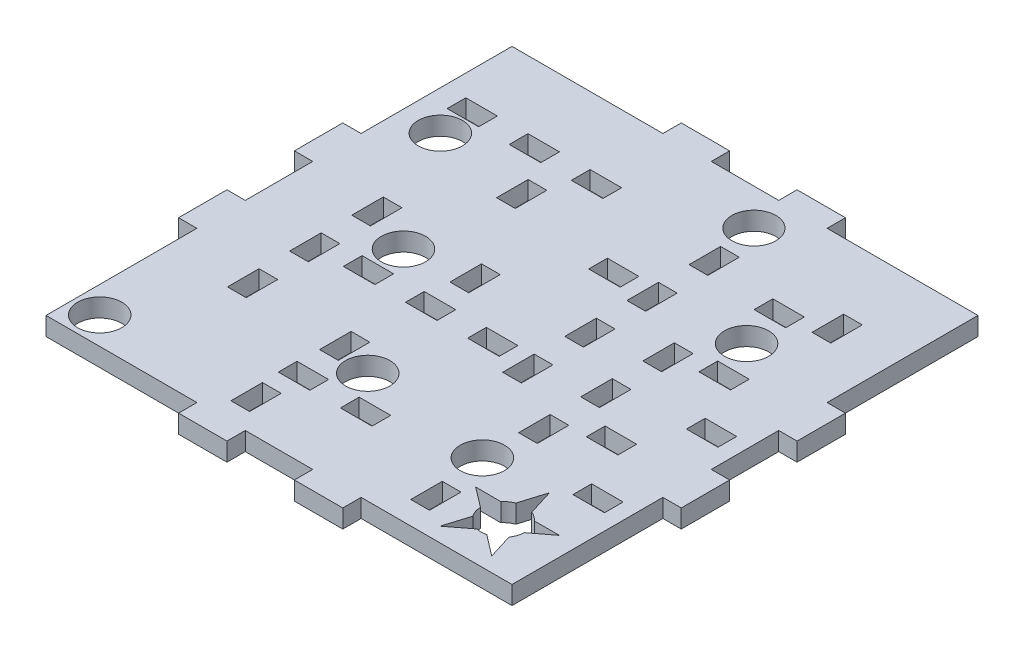
from build123d import *

# Parameters (mm, degrees)
SKETCH1_R           = 6
SKETCH1_R_2         = 6.0325
SKETCH1_W           = 8.6007
SKETCH1_H           = 5.1
SKETCH1_W_2         = 8.6042
SKETCH1_W_3         = 5.1
SKETCH1_H_2         = 8.6007
SKETCH1_H_3         = 8.6042
SKETCH1_H_4         = 8.6043
SKETCH1_W_4         = 8.6043
BOSS_EXTRUDE1_DEPTH = 5


with BuildPart() as part:
    # Sketch1 → Boss-Extrude1 (new body)
    with BuildSketch(Plane(origin=(0, 0, 0), x_dir=(1, 0, 0), z_dir=(0, 1, 0))):
        Polygon((-91.476831165, 14.589919239), (-91.476831165, 55.753419239), (-86.476831165, 55.753419239), (-86.476831165, 68.953419239), (-91.476831165, 68.953419239), (-91.476831165, 87.353419239), (-86.476831165, 87.353419239), (-86.476831165, 100.553419239), (-91.476831165, 100.553419239), (-91.476831165, 141.716919239), (-132.640331165, 141.716919239), (-132.640331165, 146.716919239), (-145.840331165, 146.716919239), (-145.840331165, 141.716919239), (-164.240331165, 141.716919239), (-164.240331165, 146.716919239), (-177.440331165, 146.716919239), (-177.440331165, 141.716919239), (-218.603831165, 141.716919239), (-218.603831165, 100.553419239), (-223.603831165, 100.553419239), (-223.603831165, 87.353419239), (-218.603831165, 87.353419239), (-218.603831165, 68.953419239), (-223.603831165, 68.953419239), (-223.603831165, 55.753419239), (-218.603831165, 55.753419239), (-218.603831165, 14.589919239), (-177.440331165, 14.589919239), (-177.440331165, 9.589919239), (-164.240331165, 9.589919239), (-164.240331165, 14.589919239), (-145.840331165, 14.589919239), (-145.840331165, 9.589919239), (-132.640331165, 9.589919239), (-132.640331165, 14.589919239), align=None)
        with Locations(Location((-142.678531165, 131.780119239, 0), (0, 0, 270))):
            Circle(SKETCH1_R, mode=Mode.SUBTRACT)
        with Locations(Location((-207.878131165, 111.439219239, 0), (0, 0, 270))):
            Circle(SKETCH1_R_2, mode=Mode.SUBTRACT)
        with Locations(Location((-116.398131165, 103.504519239, 0), (0, 0, 270))):
            Circle(SKETCH1_R_2, mode=Mode.SUBTRACT)
        with Locations(Location((-125.423931165, 40.453519239, 0), (0, 0, 270))):
            Circle(SKETCH1_R_2, mode=Mode.SUBTRACT)
        with Locations(Location((-161.052331165, 44.809519239, 0), (0, 0, 270))):
            Circle(SKETCH1_R_2, mode=Mode.SUBTRACT)
        with Locations(Location((-185.528131165, 79.031719239, 0), (0, 0, 270))):
            Circle(SKETCH1_R_2, mode=Mode.SUBTRACT)
        with Locations(Location((-211.39466844, 22.031131301, 0), (0, 0, 270))):
            Circle(SKETCH1_R_2, mode=Mode.SUBTRACT)
        with BuildLine():
            Line((-103.453731165, 32.644519239), (-96.590531165, 32.658419239))
            Line((-96.590531165, 32.658419239), (-102.031531165, 28.518719239))
            add(Edge.make_bspline(
                [(-102.031531165, 28.518719239), (-102.078231165, 27.350319239), (-102.459531165, 26.268019239), (-103.082231165, 25.364719239)],
                knots=[0.176470588, 0.176470588, 0.176470588, 0.176470588, 0.235294118, 0.235294118, 0.235294118, 0.235294118], degree=3))
            Line((-103.082231165, 25.364719239), (-100.956331165, 18.530119239))
            Line((-100.956331165, 18.530119239), (-106.678331165, 22.919119239))
            add(Edge.make_bspline(
                [(-106.678331165, 22.919119239), (-107.109931165, 22.820319239), (-107.559131165, 22.768019239), (-108.020631165, 22.768019239)],
                knots=[0.352941176, 0.352941176, 0.352941176, 0.352941176, 0.411764706, 0.411764706, 0.411764706, 0.411764706], degree=3))
            add(Edge.make_bspline(
                [(-108.020631165, 22.768019239), (-108.482031165, 22.768019239), (-108.931331165, 22.820319239), (-109.362831165, 22.919019239)],
                knots=[0.411764706, 0.411764706, 0.411764706, 0.411764706, 0.470588235, 0.470588235, 0.470588235, 0.470588235], degree=3))
            Line((-109.362831165, 22.919019239), (-115.084731165, 18.530119239))
            Line((-115.084731165, 18.530119239), (-112.958831165, 25.364719239))
            add(Edge.make_bspline(
                [(-112.958831165, 25.364719239), (-113.581531165, 26.267919239), (-113.962731165, 27.350319239), (-114.009531165, 28.518719239)],
                knots=[0.588235294, 0.588235294, 0.588235294, 0.588235294, 0.647058824, 0.647058824, 0.647058824, 0.647058824], degree=3))
            Line((-114.009531165, 28.518719239), (-119.450531165, 32.658419239))
            Line((-119.450531165, 32.658419239), (-112.587331165, 32.644519239))
            add(Edge.make_bspline(
                [(-112.587331165, 32.644519239), (-111.945431165, 33.398919239), (-111.119931165, 33.992119239), (-110.180131165, 34.355419239)],
                knots=[0.764705882, 0.764705882, 0.764705882, 0.764705882, 0.823529412, 0.823529412, 0.823529412, 0.823529412], degree=3))
            Line((-110.180131165, 34.355419239), (-108.020531165, 41.390119239))
            Line((-108.020531165, 41.390119239), (-105.860931165, 34.355419239))
            add(Edge.make_bspline(
                [(-105.860931165, 34.355419239), (-104.921031165, 33.992119239), (-104.095631165, 33.398819239), (-103.453731165, 32.644519239)],
                knots=[0, 0, 0, 0, 0.058823529, 0.058823529, 0.058823529, 0.058823529], degree=3))
        make_face(mode=Mode.SUBTRACT)
        with Locations((-169.226281165, 35.444819239)):
            Rectangle(SKETCH1_W, SKETCH1_H, mode=Mode.SUBTRACT)
        with Locations((-152.277031165, 35.444819239)):
            Rectangle(SKETCH1_W_2, SKETCH1_H, mode=Mode.SUBTRACT)
        with Locations((-123.880731165, 55.644269239)):
            Rectangle(SKETCH1_W_3, SKETCH1_H_2, mode=Mode.SUBTRACT)
        with Locations((-123.880731165, 72.593519239)):
            Rectangle(SKETCH1_W_3, SKETCH1_H_3, mode=Mode.SUBTRACT)
        with Locations((-123.880731165, 89.544469239)):
            Rectangle(SKETCH1_W_3, SKETCH1_H_4, mode=Mode.SUBTRACT)
        with Locations((-111.916681165, 92.884119239)):
            Rectangle(SKETCH1_W, SKETCH1_H, mode=Mode.SUBTRACT)
        with Locations((-111.916681165, 62.175719239)):
            Rectangle(SKETCH1_W, SKETCH1_H, mode=Mode.SUBTRACT)
        with Locations((-100.103581165, 77.655319239)):
            Rectangle(SKETCH1_W, SKETCH1_H, mode=Mode.SUBTRACT)
        with Locations((-100.103581165, 46.681519239)):
            Rectangle(SKETCH1_W, SKETCH1_H, mode=Mode.SUBTRACT)
        with Locations((-122.810431165, 25.154269239)):
            Rectangle(SKETCH1_W_3, SKETCH1_H_2, mode=Mode.SUBTRACT)
        with Locations((-119.088981165, 115.105119239)):
            Rectangle(SKETCH1_W, SKETCH1_H, mode=Mode.SUBTRACT)
        with Locations((-107.568331165, 119.396369239)):
            Rectangle(SKETCH1_W_3, SKETCH1_H_2, mode=Mode.SUBTRACT)
        with Locations((-170.668431165, 23.954769239)):
            Rectangle(SKETCH1_W_3, SKETCH1_H_2, mode=Mode.SUBTRACT)
        with Locations((-170.667231165, 48.136369239)):
            Rectangle(SKETCH1_W_3, SKETCH1_H_2, mode=Mode.SUBTRACT)
        with Locations((-140.336731165, 67.754569239)):
            Rectangle(SKETCH1_W_3, SKETCH1_H_2, mode=Mode.SUBTRACT)
        with Locations((-140.336731165, 84.703819239)):
            Rectangle(SKETCH1_W_3, SKETCH1_H_3, mode=Mode.SUBTRACT)
        with Locations((-140.336731165, 101.654769239)):
            Rectangle(SKETCH1_W_3, SKETCH1_H_4, mode=Mode.SUBTRACT)
        with Locations((-140.336731165, 118.603969239)):
            Rectangle(SKETCH1_W_3, SKETCH1_H_2, mode=Mode.SUBTRACT)
        with Locations((-168.842431165, 81.886569239)):
            Rectangle(SKETCH1_W_3, SKETCH1_H_2, mode=Mode.SUBTRACT)
        with Locations((-182.402431165, 108.159369239)):
            Rectangle(SKETCH1_W_3, SKETCH1_H_2, mode=Mode.SUBTRACT)
        with Locations((-151.258781165, 102.139019239)):
            Rectangle(SKETCH1_W, SKETCH1_H, mode=Mode.SUBTRACT)
        with Locations((-185.323281165, 69.281219239)):
            Rectangle(SKETCH1_W, SKETCH1_H, mode=Mode.SUBTRACT)
        with Locations((-168.374031165, 69.281219239)):
            Rectangle(SKETCH1_W_2, SKETCH1_H, mode=Mode.SUBTRACT)
        with Locations((-151.423081165, 69.281219239)):
            Rectangle(SKETCH1_W_4, SKETCH1_H, mode=Mode.SUBTRACT)
        with Locations((-198.035431165, 50.385069239)):
            Rectangle(SKETCH1_W_3, SKETCH1_H_2, mode=Mode.SUBTRACT)
        with Locations((-198.035431165, 67.334319239)):
            Rectangle(SKETCH1_W_3, SKETCH1_H_3, mode=Mode.SUBTRACT)
        with Locations((-198.035431165, 84.285269239)):
            Rectangle(SKETCH1_W_3, SKETCH1_H_4, mode=Mode.SUBTRACT)
        with Locations((-174.558181165, 120.722319239)):
            Rectangle(SKETCH1_W, SKETCH1_H, mode=Mode.SUBTRACT)
        with Locations((-191.507431165, 120.722319239)):
            Rectangle(SKETCH1_W_2, SKETCH1_H, mode=Mode.SUBTRACT)
        with Locations((-208.458381165, 120.722319239)):
            Rectangle(SKETCH1_W_4, SKETCH1_H, mode=Mode.SUBTRACT)
    extrude(amount=BOSS_EXTRUDE1_DEPTH)


solid = part.part
